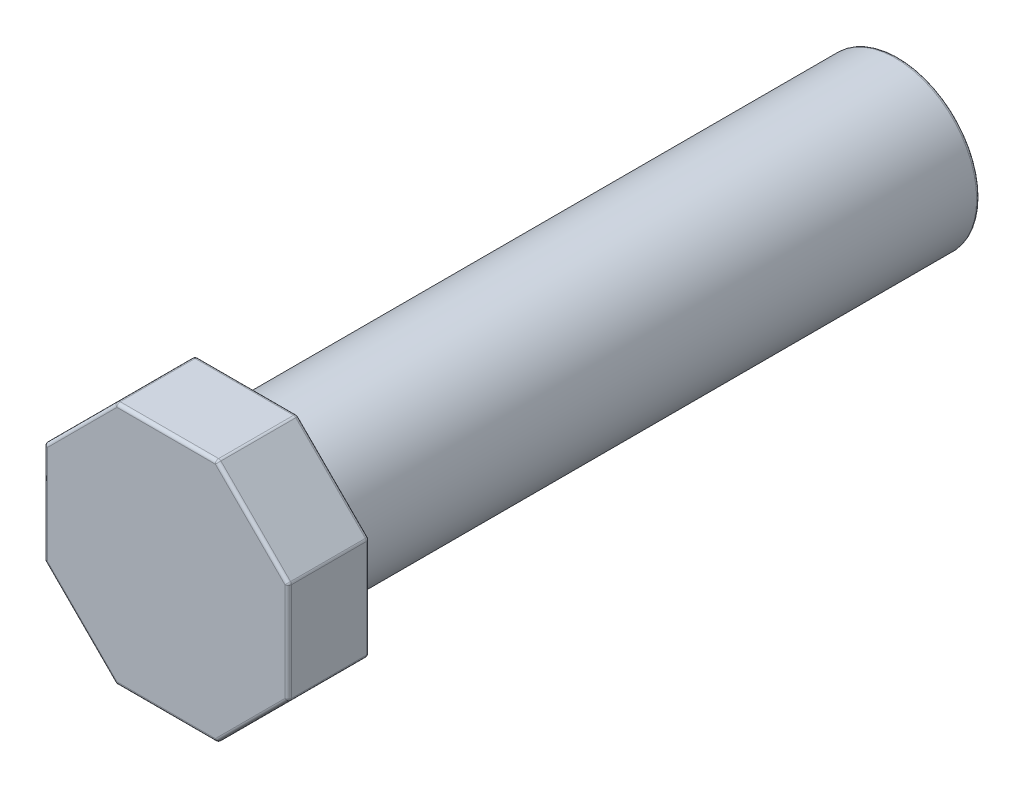
from build123d import *

# Parameters (mm, degrees)
SKETCH1_R           = 6.35
BOSS_EXTRUDE1_DEPTH = 50.8
BOSS_EXTRUDE3_DEPTH = 6.35
FILLET1_R           = 0.254
FILLET2_R           = 0.254


with BuildPart() as part:
    # Sketch1 → Boss-Extrude1 (new body)
    with BuildSketch(Plane.XY):
        Circle(SKETCH1_R)
    extrude(amount=BOSS_EXTRUDE1_DEPTH)

    # Sketch2 → Boss-Extrude3 (add)
    with BuildSketch(Plane.XY.offset(50.8)):
        Polygon((-3.945384182, 9.525), (-9.525, 3.945384182), (-9.525, -3.945384182), (-3.945384182, -9.525), (3.945384182, -9.525), (9.525, -3.945384182), (9.525, 3.945384182), (3.945384182, 9.525), align=None)
    extrude(amount=BOSS_EXTRUDE3_DEPTH)


with BuildPart() as body_2:
    # Split1: the piece on the far side of the plane
    add(part.part)
    split(bisect_by=Plane(origin=(0, 0, 50.8), x_dir=(-1, 0, 0), z_dir=(0, 0, -1)), keep=Keep.BOTTOM)

    # Fillet1
    fillet1_edges = [body_2.edges().sort_by_distance(p)[0] for p in [
        (3.945384182, 9.525, 53.975),
        (6.735192091, 6.735192091, 50.8),
        (0, 9.525, 50.8),
        (-6.735192091, 6.735192091, 50.8),
        (-9.525, 0, 50.8),
        (-6.735192091, -6.735192091, 50.8),
        (0, -9.525, 50.8),
        (6.735192091, -6.735192091, 50.8),
        (9.525, 0, 50.8),
        (6.735192091, 6.735192091, 57.15),
        (0, 9.525, 57.15),
        (-6.735192091, 6.735192091, 57.15),
        (-9.525, 0, 57.15),
        (-6.735192091, -6.735192091, 57.15),
        (0, -9.525, 57.15),
        (6.735192091, -6.735192091, 57.15),
        (9.525, 0, 57.15),
        (9.525, 3.945384182, 53.975),
        (9.525, -3.945384182, 53.975),
        (3.945384182, -9.525, 53.975),
        (-3.945384182, -9.525, 53.975),
        (-9.525, -3.945384182, 53.975),
        (-9.525, 3.945384182, 53.975),
        (-3.945384182, 9.525, 53.975),
    ]]
    fillet(fillet1_edges, radius=FILLET1_R)


with BuildPart() as part_1:
    add(part.part)

    # Split1
    split(bisect_by=Plane(origin=(0, 0, 50.8), x_dir=(-1, 0, 0), z_dir=(0, 0, -1)), keep=Keep.TOP)

    # Fillet2
    fillet2_edges = [part_1.edges().sort_by_distance(p)[0] for p in [
        (-6.35, 0, 0),
    ]]
    fillet(fillet2_edges, radius=FILLET2_R)


solid = Compound([body_2.part, part_1.part])
